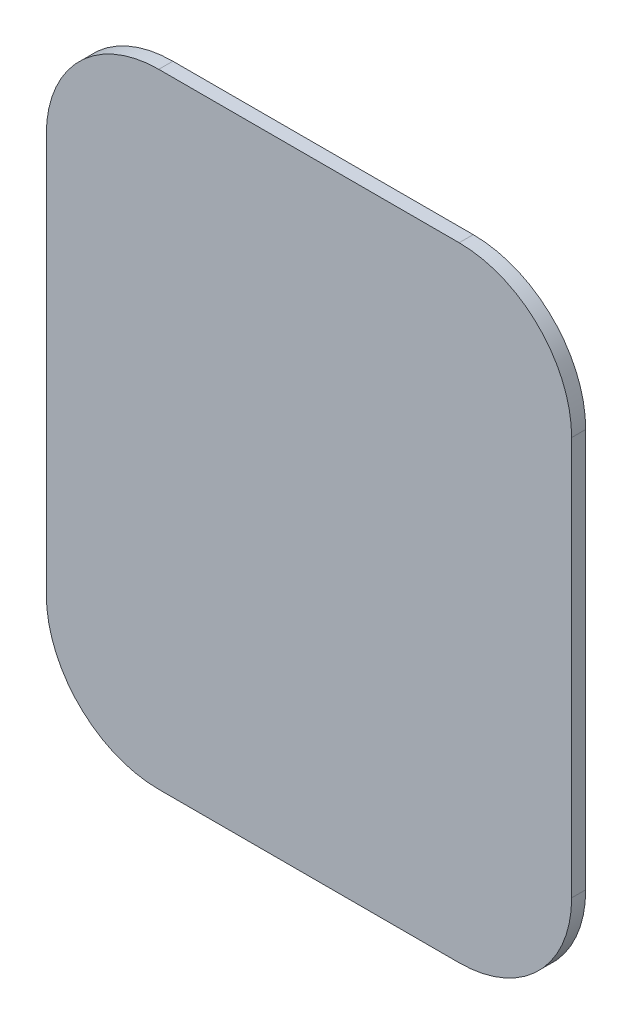
from build123d import *

# Parameters (mm, degrees)
EXTRUDE_1_DEPTH = 1


with BuildPart() as part:
    # 草图2 → 凸台-拉伸1 (new body)
    with BuildSketch(Plane.XY):
        with BuildLine():
            Line((-10.682698898, 22.17637267), (10.682698898, 22.17637267))
            ThreePointArc((10.682698898, 22.17637267), (16.339553148, 19.833226919), (18.682698898, 14.17637267))
            Line((18.682698898, 14.17637267), (18.682698898, -14.17637267))
            ThreePointArc((18.682698898, -14.17637267), (16.339553148, -19.833226919), (10.682698898, -22.17637267))
            Line((10.682698898, -22.17637267), (-10.682698898, -22.17637267))
            ThreePointArc((-10.682698898, -22.17637267), (-16.339553148, -19.833226919), (-18.682698898, -14.17637267))
            Line((-18.682698898, -14.17637267), (-18.682698898, 14.17637267))
            ThreePointArc((-18.682698898, 14.17637267), (-16.339553148, 19.833226919), (-10.682698898, 22.17637267))
        make_face()
    extrude(amount=EXTRUDE_1_DEPTH)


solid = part.part
